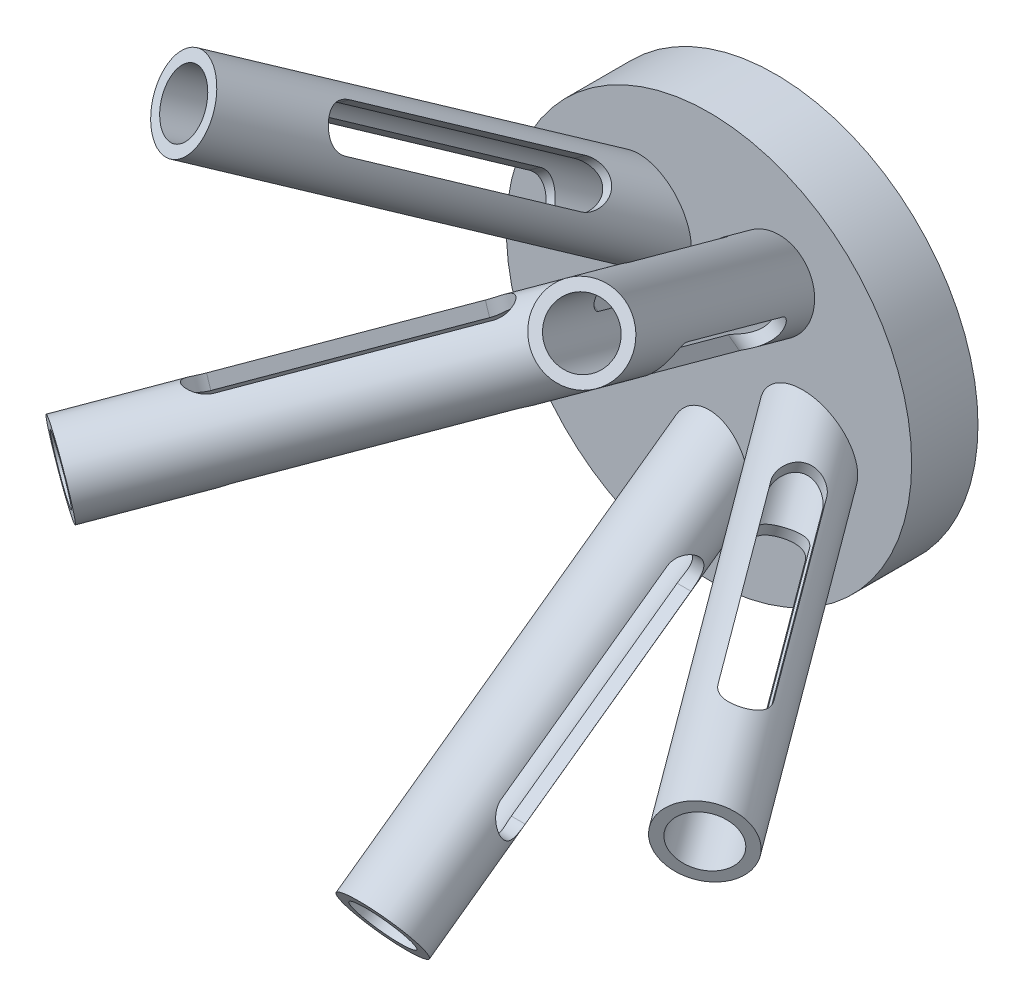
from build123d import *

# Parameters (mm, degrees)
SKETCH1_R            = 55
BOSS_EXTRUDE1_DEPTH  = 9
SWEEP2_PROFILE_R     = 11
CUT_SWEEP1_PROFILE_R = 8
CUT_SWEEP7_PROFILE_R = 2.5
CUT_EXTRUDE1_DEPTH   = 20
CIRPATTERN1_COUNT    = 5


with BuildPart() as part:
    # Sketch1 → Boss-Extrude1 (new, symmetric)
    with BuildSketch(Plane.XY):
        Circle(SKETCH1_R)
    extrude(amount=BOSS_EXTRUDE1_DEPTH, both=True)

    # Sweep2: sweep along a path in Sketch3
    with BuildLine(Plane(origin=(0, 0, 0), x_dir=(0, 0, -1), z_dir=(1, 0, 0))) as sweep2_path:
        Line((0, -22), (-97.537036334, -91.903694775))
    # Sweep2 profile (on start of the path) → Sweep2 (sweep)
    with BuildSketch(Plane(origin=(0, -22, 0), x_dir=(0, 0.8128086361148117, 0.5825307897932775), z_dir=(0, -0.5825307897932775, 0.8128086361148117))):
        Circle(SWEEP2_PROFILE_R)
    sweep2 = sweep(path=sweep2_path.line)

    # Cut-Sweep1: sweep along a path in Sketch3<2>
    with BuildLine(Plane(origin=(0, 0, 0), x_dir=(0, 0, -1), z_dir=(1, 0, 0))) as cut_sweep1_path:
        Line((0, -22), (-97.537036334, -91.903694775))
    # Cut-Sweep1 profile (on start of the path) → Cut-Sweep1 (sweep, cut)
    with BuildSketch(Plane(origin=(0, -22, 0), x_dir=(0, 0.8128086361148117, 0.5825307897932775), z_dir=(0, -0.5825307897932775, 0.8128086361148117))):
        Circle(CUT_SWEEP1_PROFILE_R)
    cut_sweep1 = sweep(path=cut_sweep1_path.line, mode=Mode.SUBTRACT)

    # Cut-Sweep7: sweep along a path in Sketch199
    with BuildLine(Plane(origin=(0, 0, 0), x_dir=(0, 0, -1), z_dir=(1, 0, 0))) as cut_sweep7_path:
        Line((5.317627658, -21.308382404), (-9, -28.450198577))
    # Cut-Sweep7 profile (on start of the path) → Cut-Sweep7 (sweep, cut)
    with BuildSketch(Plane(origin=(0, -21.308382404, -5.317627658), x_dir=(0, 0.89485172861867, 0.44636351081621606), z_dir=(0, -0.44636351081621606, 0.89485172861867))):
        Circle(CUT_SWEEP7_PROFILE_R)
    cut_sweep7 = sweep(path=cut_sweep7_path.line, mode=Mode.SUBTRACT)

    # Sketch534 → Cut-Extrude1 (cut, symmetric)
    with BuildSketch(Plane(origin=(0, 0, 0), x_dir=(0, 0, -1), z_dir=(1, 0, 0))):
        with BuildLine():
            Line((-74.877715038, -68.787564731), (-29.88783343, -36.543823583))
            ThreePointArc((-29.88783343, -36.543823583), (-22.088949562, -37.830901226), (-23.376027206, -45.629785094))
            Line((-23.376027206, -45.629785094), (-68.365908815, -77.873526242))
            ThreePointArc((-68.365908815, -77.873526242), (-76.164792682, -76.586448598), (-74.877715038, -68.787564731))
        make_face()
    cut_extrude1 = extrude(amount=CUT_EXTRUDE1_DEPTH, both=True, mode=Mode.SUBTRACT)

    # CirPattern1: Sweep2, Cut-Sweep1, Cut-Sweep7, Cut-Extrude1 ×5 about axis
    cirpattern1_axis = Axis((0, 0, 0), (0, 0, 1))
    add([sweep2.rotate(cirpattern1_axis, i * 360 / CIRPATTERN1_COUNT) for i in range(1, CIRPATTERN1_COUNT)])
    add([cut_sweep1.rotate(cirpattern1_axis, i * 360 / CIRPATTERN1_COUNT) for i in range(1, CIRPATTERN1_COUNT)], mode=Mode.SUBTRACT)
    add([cut_sweep7.rotate(cirpattern1_axis, i * 360 / CIRPATTERN1_COUNT) for i in range(1, CIRPATTERN1_COUNT)], mode=Mode.SUBTRACT)
    add([cut_extrude1.rotate(cirpattern1_axis, i * 360 / CIRPATTERN1_COUNT) for i in range(1, CIRPATTERN1_COUNT)], mode=Mode.SUBTRACT)

    # Sketch535 → Cut-Revolve1 (revolve, cut)
    with BuildSketch(Plane(origin=(0, 0, 0), x_dir=(0, 0, -1), z_dir=(1, 0, 0))):
        Polygon((9, -40), (4, -40), (4, -37), (-1, -37), (-1, -47), (4, -47), (4, -44), (9, -44), align=None)
    revolve(axis=Axis((0, 0, 0), (0, 0, 1)), mode=Mode.SUBTRACT)


solid = part.part
